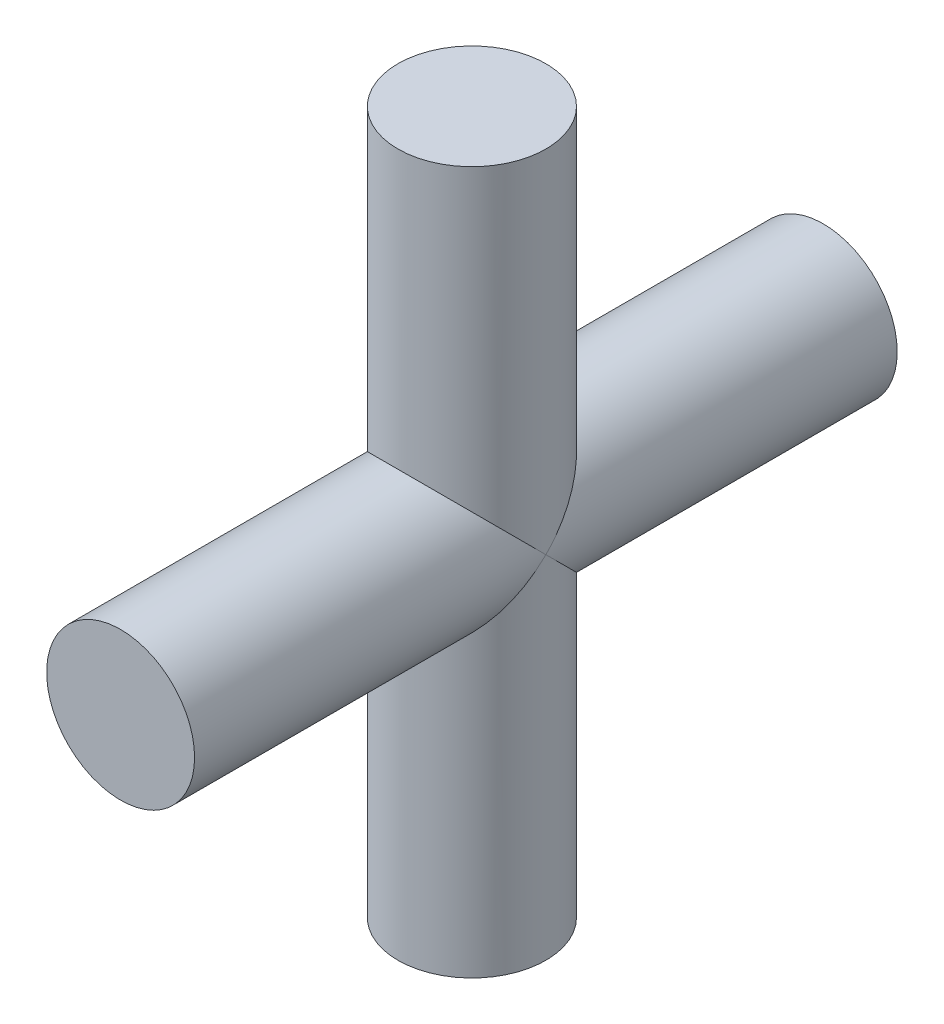
from build123d import *

# Parameters (mm, degrees)
SKETCH1_R                = 2
BOSS_EXTRUDE1_DEPTH      = 19
BOSS_EXTRUDE2_DEPTH      = 9.5
BOSS_EXTRUDE2_DEPTH_BACK = 9.5
SKETCH2_R                = 2


with BuildPart() as part:
    # Sketch1 → Boss-Extrude1 (new body)
    with BuildSketch(Plane(origin=(0, 0, 0), x_dir=(1, 0, 0), z_dir=(0, 1, 0))):
        Circle(SKETCH1_R)
    extrude(amount=BOSS_EXTRUDE1_DEPTH)

    # Sketch2 → Boss-Extrude2 (add, two sides: drawn at the far end of the back side and taken through both)
    with BuildSketch(Plane.XY.offset(-BOSS_EXTRUDE2_DEPTH_BACK)):
        with Locations((0, 9.5)):
            Circle(SKETCH2_R)
    extrude(amount=BOSS_EXTRUDE2_DEPTH + BOSS_EXTRUDE2_DEPTH_BACK)


solid = part.part
